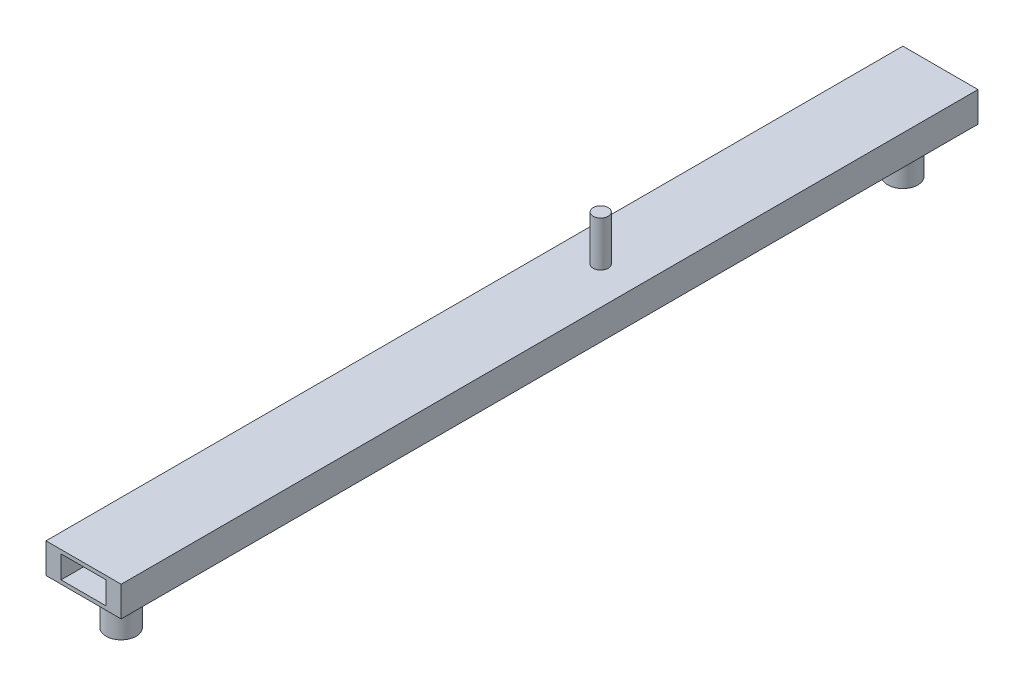
from build123d import *

# Parameters (mm, degrees)
SKETCH_1_W      = 50
SKETCH_1_H      = 20
SKETCH_1_W_2    = 30
SKETCH_1_H_2    = 15
EXTRUDE_1_DEPTH = 285
SKETCH_2_R      = 10
EXTRUDE_2_DEPTH = 30
SKETCH_3_R      = 5
EXTRUDE_3_DEPTH = 30


with BuildPart() as part:
    # Эскиз1 → Бобышка-Вытянуть1 (new, symmetric)
    with BuildSketch(Plane.XY):
        Rectangle(SKETCH_1_W, SKETCH_1_H)
        Rectangle(SKETCH_1_W_2, SKETCH_1_H_2, mode=Mode.SUBTRACT)
    extrude(amount=EXTRUDE_1_DEPTH, both=True)

    # Эскиз2 → Бобышка-Вытянуть2 (add)
    with BuildSketch(Plane.XZ.offset(10)):
        with Locations(Location((0, 260, 0), (0, 0, 90))):
            Circle(SKETCH_2_R)
        with Locations(Location((0, -260, 0), (0, 0, 90))):
            Circle(SKETCH_2_R)
    extrude(amount=EXTRUDE_2_DEPTH)

    # Эскиз3 → Бобышка-Вытянуть3 (add)
    with BuildSketch(Plane(origin=(0, 10, 0), x_dir=(1, 0, 0), z_dir=(0, 1, 0))):
        with Locations(Location((0, 59, 0), (0, 0, 90))):
            Circle(SKETCH_3_R)
    extrude(amount=EXTRUDE_3_DEPTH)


solid = part.part
